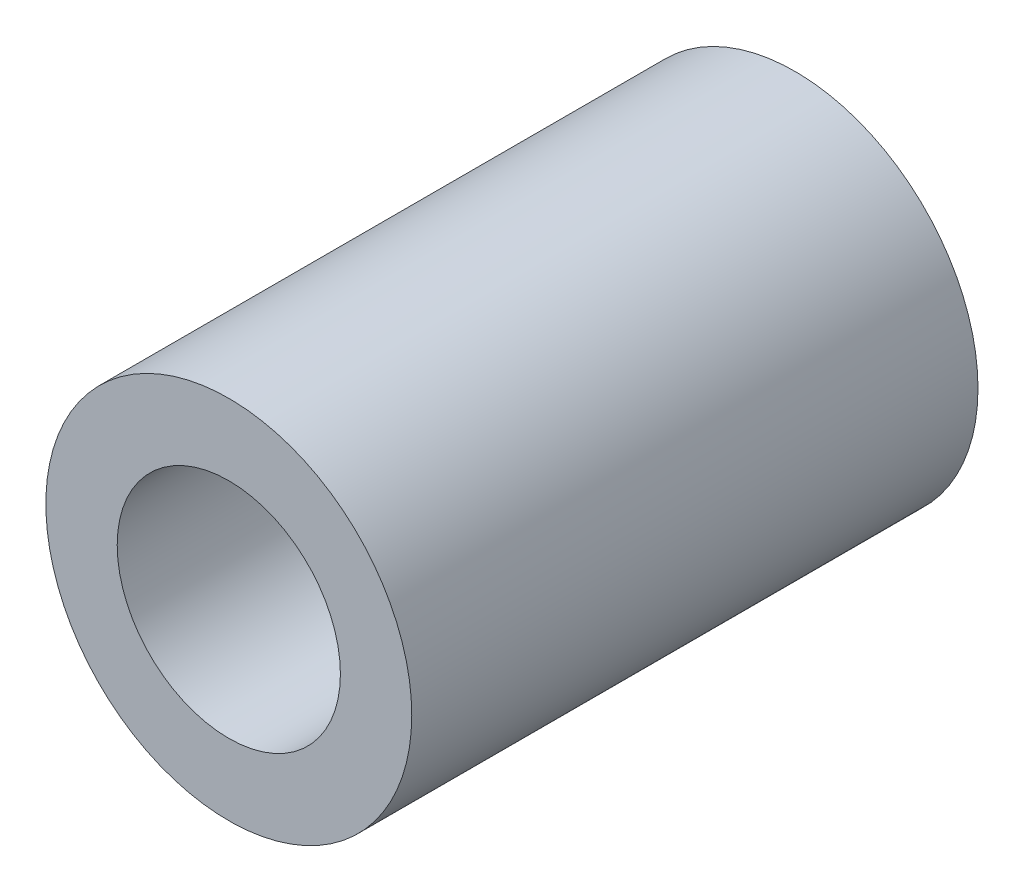
from build123d import *

# Parameters (mm, degrees)
SKETCH1_R           = 10
SKETCH1_R_2         = 6.1
BOSS_EXTRUDE1_DEPTH = 15.475


with BuildPart() as part:
    # Sketch1 → Boss-Extrude1 (new, symmetric)
    with BuildSketch(Plane.XY):
        Circle(SKETCH1_R)
        Circle(SKETCH1_R_2, mode=Mode.SUBTRACT)
    extrude(amount=BOSS_EXTRUDE1_DEPTH, both=True)


solid = part.part
